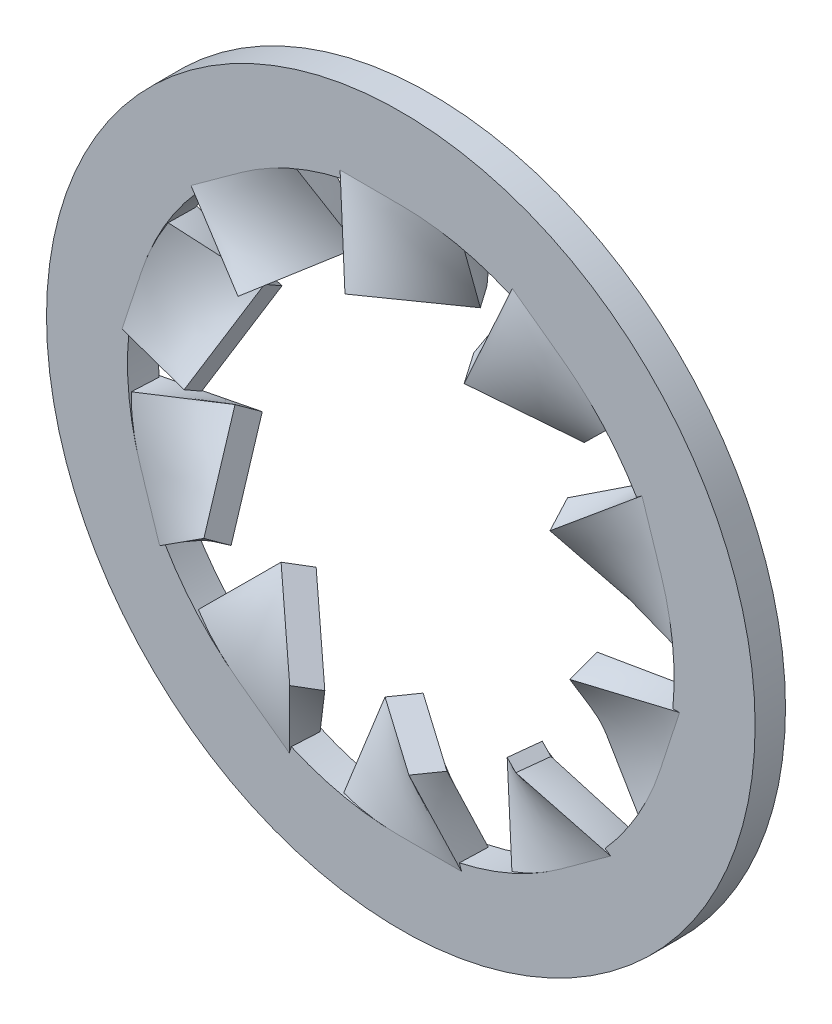
from build123d import *

# Parameters (mm, degrees)
CIRPATTERN1_COUNT = 10
SKETCH5_R         = 8.89
SKETCH5_R_2       = 6.858
EXTRUDE1_DEPTH    = 0.381


with BuildPart() as part:
    # Sketch2 → Loft2 section 0
    with BuildSketch(Plane(origin=(0, 6.858, 0), x_dir=(-1, 0, 0), z_dir=(0, 1, 0))):
        with BuildLine():
            Line((-1.524, 0.381), (1.524, 0.381))
            Line((1.524, 0.381), (1.524, -0.381))
            Line((1.524, -0.381), (-1.524, -0.381))
            Line((-1.524, -0.381), (-1.524, 0.381))
        make_face()
    # Sketch3 → Loft2 section 1
    with BuildSketch(Plane(origin=(0, 4.826, 0), x_dir=(-1, 0, 0), z_dir=(0, 1, 0))):
        with BuildLine():
            Line((-1.195389532, -0.418417155), (-0.802030812, -0.980191627))
            Line((-0.802030812, -0.980191627), (1.195389532, 0.418417155))
            Line((1.195389532, 0.418417155), (0.802030812, 0.980191627))
            Line((0.802030812, 0.980191627), (-1.195389532, -0.418417155))
        make_face()
    loft()


with BuildPart() as cirpattern1_1:
    # CirPattern1: pattern copy
    add(part.part.rotate(Axis((0, 0, -0.381), (0, 0, 1)), 1 * 360 / CIRPATTERN1_COUNT))


with BuildPart() as cirpattern1_2:
    # CirPattern1: pattern copy
    add(part.part.rotate(Axis((0, 0, -0.381), (0, 0, 1)), 2 * 360 / CIRPATTERN1_COUNT))


with BuildPart() as cirpattern1_3:
    # CirPattern1: pattern copy
    add(part.part.rotate(Axis((0, 0, -0.381), (0, 0, 1)), 3 * 360 / CIRPATTERN1_COUNT))


with BuildPart() as cirpattern1_4:
    # CirPattern1: pattern copy
    add(part.part.rotate(Axis((0, 0, -0.381), (0, 0, 1)), 4 * 360 / CIRPATTERN1_COUNT))


with BuildPart() as cirpattern1_5:
    # CirPattern1: pattern copy
    add(part.part.rotate(Axis((0, 0, -0.381), (0, 0, 1)), 5 * 360 / CIRPATTERN1_COUNT))


with BuildPart() as cirpattern1_6:
    # CirPattern1: pattern copy
    add(part.part.rotate(Axis((0, 0, -0.381), (0, 0, 1)), 6 * 360 / CIRPATTERN1_COUNT))


with BuildPart() as cirpattern1_7:
    # CirPattern1: pattern copy
    add(part.part.rotate(Axis((0, 0, -0.381), (0, 0, 1)), 7 * 360 / CIRPATTERN1_COUNT))


with BuildPart() as cirpattern1_8:
    # CirPattern1: pattern copy
    add(part.part.rotate(Axis((0, 0, -0.381), (0, 0, 1)), 8 * 360 / CIRPATTERN1_COUNT))


with BuildPart() as cirpattern1_9:
    # CirPattern1: pattern copy
    add(part.part.rotate(Axis((0, 0, -0.381), (0, 0, 1)), 9 * 360 / CIRPATTERN1_COUNT))


with BuildPart() as part_1:
    add(part.part)

    add(cirpattern1_1.part)  # Extrude1 merges CirPattern1_1

    add(cirpattern1_2.part)  # Extrude1 merges CirPattern1_2

    add(cirpattern1_3.part)  # Extrude1 merges CirPattern1_3

    add(cirpattern1_4.part)  # Extrude1 merges CirPattern1_4

    add(cirpattern1_5.part)  # Extrude1 merges CirPattern1_5

    add(cirpattern1_6.part)  # Extrude1 merges CirPattern1_6

    add(cirpattern1_7.part)  # Extrude1 merges CirPattern1_7

    add(cirpattern1_8.part)  # Extrude1 merges CirPattern1_8

    add(cirpattern1_9.part)  # Extrude1 merges CirPattern1_9
    # Sketch5 → Extrude1 (add, symmetric)
    with BuildSketch(Plane.XY):
        Circle(SKETCH5_R)
        Circle(SKETCH5_R_2, mode=Mode.SUBTRACT)
    extrude(amount=EXTRUDE1_DEPTH, both=True)


solid = part_1.part
